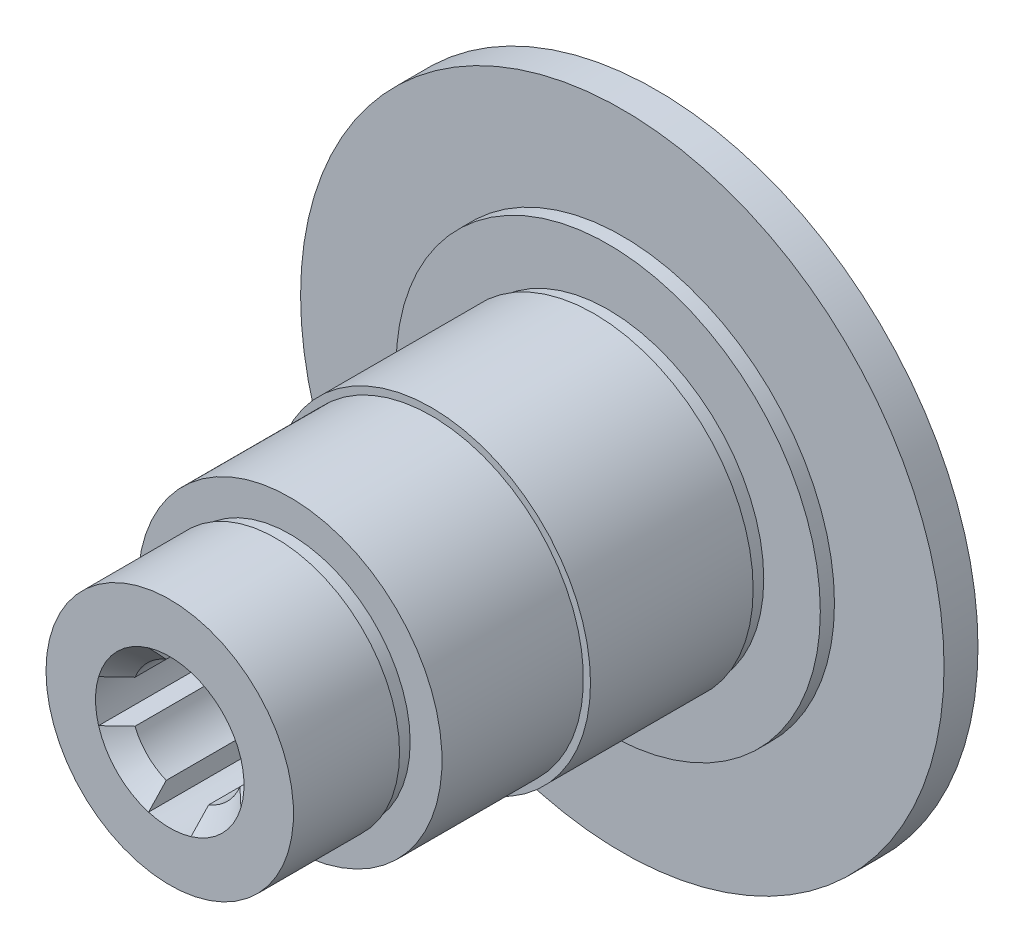
from build123d import *

# Parameters (mm, degrees)
SKETCH_2_OUTSIDE_W  = 123.846
SKETCH_2_OUTSIDE_H  = 123.846
SKETCH_2_OUTSIDE_R  = 17
CUT_EXTRUDE_1_DEPTH = 2
SKETCH_3_OUTSIDE_W  = 123.846
SKETCH_3_OUTSIDE_H  = 123.846
SKETCH_3_OUTSIDE_R  = 22
CUT_EXTRUDE_2_DEPTH = 2
CUT_EXTRUDE_3_DEPTH = 107.609099049
CHAMFER_1_SIZE      = 2.5


with BuildPart() as part:
    # 草图1 → 旋转1 (revolve)
    with BuildSketch(Plane(origin=(0, 0, 0), x_dir=(0, 0, -1), z_dir=(1, 0, 0)), mode=Mode.PRIVATE) as revolve_1_sk:
        Polygon((0, 0), (0, 17.5), (17, 17.5), (17, 21.5), (37, 21.5), (37, 22.5), (62, 22.5), (62, 30), (64, 30), (64, 45.5), (68.796097738, 45.5), (85, 13), (85, 0), align=None)
    revolve(revolve_1_sk.sketch.rotate(Axis((0, 0, -85), (0, 0, 1)), 90), axis=Axis((0, 0, -85), (0, 0, 1)))

    # 草图2 outside → 切除-拉伸1 (cut)
    with BuildSketch(Plane.XY.offset(-17)):
        Rectangle(SKETCH_2_OUTSIDE_W, SKETCH_2_OUTSIDE_H)
        Circle(SKETCH_2_OUTSIDE_R, mode=Mode.SUBTRACT)
    extrude(amount=CUT_EXTRUDE_1_DEPTH, mode=Mode.SUBTRACT)

    # 草图3 outside → 切除-拉伸2 (cut)
    with BuildSketch(Plane.XY.offset(-62)):
        Rectangle(SKETCH_3_OUTSIDE_W, SKETCH_3_OUTSIDE_H)
        Circle(SKETCH_3_OUTSIDE_R, mode=Mode.SUBTRACT)
    extrude(amount=CUT_EXTRUDE_2_DEPTH, mode=Mode.SUBTRACT)

    # 草图4 → 切除-拉伸3 (cut, through all)
    with BuildSketch(Plane.XY):
        with BuildLine():
            Line((-3, 10.062305899), (-3, 7.416198487))
            ThreePointArc((-3, 7.416198487), (-5.656854249, 5.656854249), (-7.416198487, 3))
            Line((-7.416198487, 3), (-10.062305899, 3))
            ThreePointArc((-10.062305899, 3), (-10.5, 0), (-10.062305899, -3))
            Line((-10.062305899, -3), (-7.416198487, -3))
            ThreePointArc((-7.416198487, -3), (-5.656854249, -5.656854249), (-3, -7.416198487))
            Line((-3, -7.416198487), (-3, -10.062305899))
            ThreePointArc((-3, -10.062305899), (0, -10.5), (3, -10.062305899))
            Line((3, -10.062305899), (3, -7.416198487))
            ThreePointArc((3, -7.416198487), (5.656854249, -5.656854249), (7.416198487, -3))
            Line((7.416198487, -3), (10.062305899, -3))
            ThreePointArc((10.062305899, -3), (10.5, 0), (10.062305899, 3))
            Line((10.062305899, 3), (7.416198487, 3))
            ThreePointArc((7.416198487, 3), (5.656854249, 5.656854249), (3, 7.416198487))
            Line((3, 7.416198487), (3, 10.062305899))
            ThreePointArc((3, 10.062305899), (0, 10.5), (-3, 10.062305899))
        make_face()
    extrude(amount=-CUT_EXTRUDE_3_DEPTH, mode=Mode.SUBTRACT)

    # 倒角1
    chamfer_1_edges = [part.edges().sort_by_distance(p)[0] for p in [
        (5.656854249, -5.656854249, -85),
        (5.656854249, 5.656854249, -85),
        (-5.656854249, 5.656854249, -85),
        (-5.656854249, -5.656854249, -85),
        (-5.656854249, -5.656854249, 0),
        (5.656854249, -5.656854249, 0),
        (5.656854249, 5.656854249, 0),
        (-5.656854249, 5.656854249, 0),
    ]]
    chamfer(chamfer_1_edges, length=CHAMFER_1_SIZE)


solid = part.part
